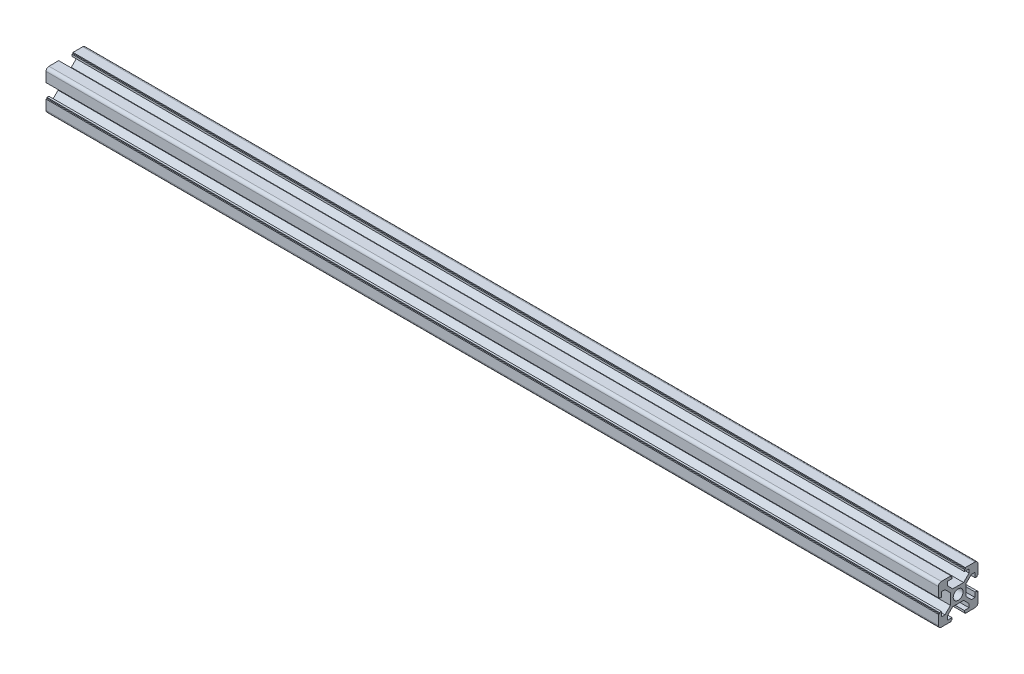
from build123d import *

# Parameters (mm, degrees)
SKETCH1_R                = 2.5
F_20_X_20_X_R1_5_1_DEPTH = 450


with BuildPart() as part:
    # Sketch1 → 铝型材 20 X 20 X R1.5(1) (new body)
    with BuildSketch(Plane(origin=(0, 0, 0), x_dir=(0, 0, -1), z_dir=(1, 0, 0))):
        with BuildLine():
            Line((-3.6, 10), (-3.6, 9.5))
            Line((-3.6, 9.5), (-3.1, 9.5))
            Line((-3.1, 9.5), (-3.1, 8.5))
            Line((-3.1, 8.5), (-5.5, 8.5))
            Line((-5.5, 8.5), (-5.5, 6.65))
            Line((-5.5, 6.65), (-2.75, 3.9))
            Line((-2.75, 3.9), (2.75, 3.9))
            Line((2.75, 3.9), (5.5, 6.65))
            Line((5.5, 6.65), (5.5, 8.5))
            Line((5.5, 8.5), (3.1, 8.5))
            Line((3.1, 8.5), (3.1, 9.5))
            Line((3.1, 9.5), (3.6, 9.5))
            Line((3.6, 9.5), (3.6, 10))
            Line((3.6, 10), (8.5, 10))
            ThreePointArc((8.5, 10), (9.560660172, 9.560660172), (10, 8.5))
            Line((10, 8.5), (10, 3.6))
            Line((10, 3.6), (9.5, 3.6))
            Line((9.5, 3.6), (9.5, 3.1))
            Line((9.5, 3.1), (8.5, 3.1))
            Line((8.5, 3.1), (8.5, 5.5))
            Line((8.5, 5.5), (6.65, 5.5))
            Line((6.65, 5.5), (3.9, 2.75))
            Line((3.9, 2.75), (3.9, -2.75))
            Line((3.9, -2.75), (6.65, -5.5))
            Line((6.65, -5.5), (8.5, -5.5))
            Line((8.5, -5.5), (8.5, -3.1))
            Line((8.5, -3.1), (9.5, -3.1))
            Line((9.5, -3.1), (9.5, -3.6))
            Line((9.5, -3.6), (10, -3.6))
            Line((10, -3.6), (10, -8.5))
            ThreePointArc((10, -8.5), (9.560660172, -9.560660172), (8.5, -10))
            Line((8.5, -10), (3.6, -10))
            Line((3.6, -10), (3.6, -9.5))
            Line((3.6, -9.5), (3.1, -9.5))
            Line((3.1, -9.5), (3.1, -8.5))
            Line((3.1, -8.5), (5.5, -8.5))
            Line((5.5, -8.5), (5.5, -6.65))
            Line((5.5, -6.65), (2.75, -3.9))
            Line((2.75, -3.9), (-2.75, -3.9))
            Line((-2.75, -3.9), (-5.5, -6.65))
            Line((-5.5, -6.65), (-5.5, -8.5))
            Line((-5.5, -8.5), (-3.1, -8.5))
            Line((-3.1, -8.5), (-3.1, -9.5))
            Line((-3.1, -9.5), (-3.6, -9.5))
            Line((-3.6, -9.5), (-3.6, -10))
            Line((-3.6, -10), (-8.5, -10))
            ThreePointArc((-8.5, -10), (-9.560660172, -9.560660172), (-10, -8.5))
            Line((-10, -8.5), (-10, -3.6))
            Line((-10, -3.6), (-9.5, -3.6))
            Line((-9.5, -3.6), (-9.5, -3.1))
            Line((-9.5, -3.1), (-8.5, -3.1))
            Line((-8.5, -3.1), (-8.5, -5.5))
            Line((-8.5, -5.5), (-6.65, -5.5))
            Line((-6.65, -5.5), (-3.9, -2.75))
            Line((-3.9, -2.75), (-3.9, 2.75))
            Line((-3.9, 2.75), (-6.65, 5.5))
            Line((-6.65, 5.5), (-8.5, 5.5))
            Line((-8.5, 5.5), (-8.5, 3.1))
            Line((-8.5, 3.1), (-9.5, 3.1))
            Line((-9.5, 3.1), (-9.5, 3.6))
            Line((-9.5, 3.6), (-10, 3.6))
            Line((-10, 3.6), (-10, 8.5))
            ThreePointArc((-10, 8.5), (-9.560660172, 9.560660172), (-8.5, 10))
            Line((-8.5, 10), (-3.6, 10))
        make_face()
        Circle(SKETCH1_R, mode=Mode.SUBTRACT)
    extrude(amount=F_20_X_20_X_R1_5_1_DEPTH)


solid = part.part
